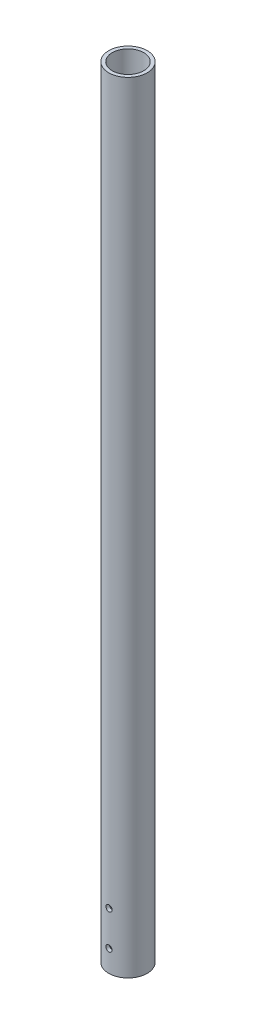
from build123d import *

# Parameters (mm, degrees)
SKETCH1_R               = 21.082
SKETCH1_R_2             = 17.272
BOSS_EXTRUDE1_DEPTH     = 855.6625
F_1_4_CLEARANCE_HOLE1_D = 6.7564


with BuildPart() as part:
    # Sketch1 → Boss-Extrude1 (new body)
    with BuildSketch(Plane(origin=(0, 0, 0), x_dir=(1, 0, 0), z_dir=(0, 1, 0))):
        with Locations(Location((0, 0, 0), (0, 0, 270))):
            Circle(SKETCH1_R)
        with Locations(Location((0, 0, 0), (0, 0, 270))):
            Circle(SKETCH1_R_2, mode=Mode.SUBTRACT)
    extrude(amount=BOSS_EXTRUDE1_DEPTH)

    # 1/4 Clearance Hole1 (through all)
    with Locations(Plane.XY.offset(21.082)):
        with Locations((0, 23.8125), (0, 61.9125)):
            Hole(F_1_4_CLEARANCE_HOLE1_D / 2)


solid = part.part
